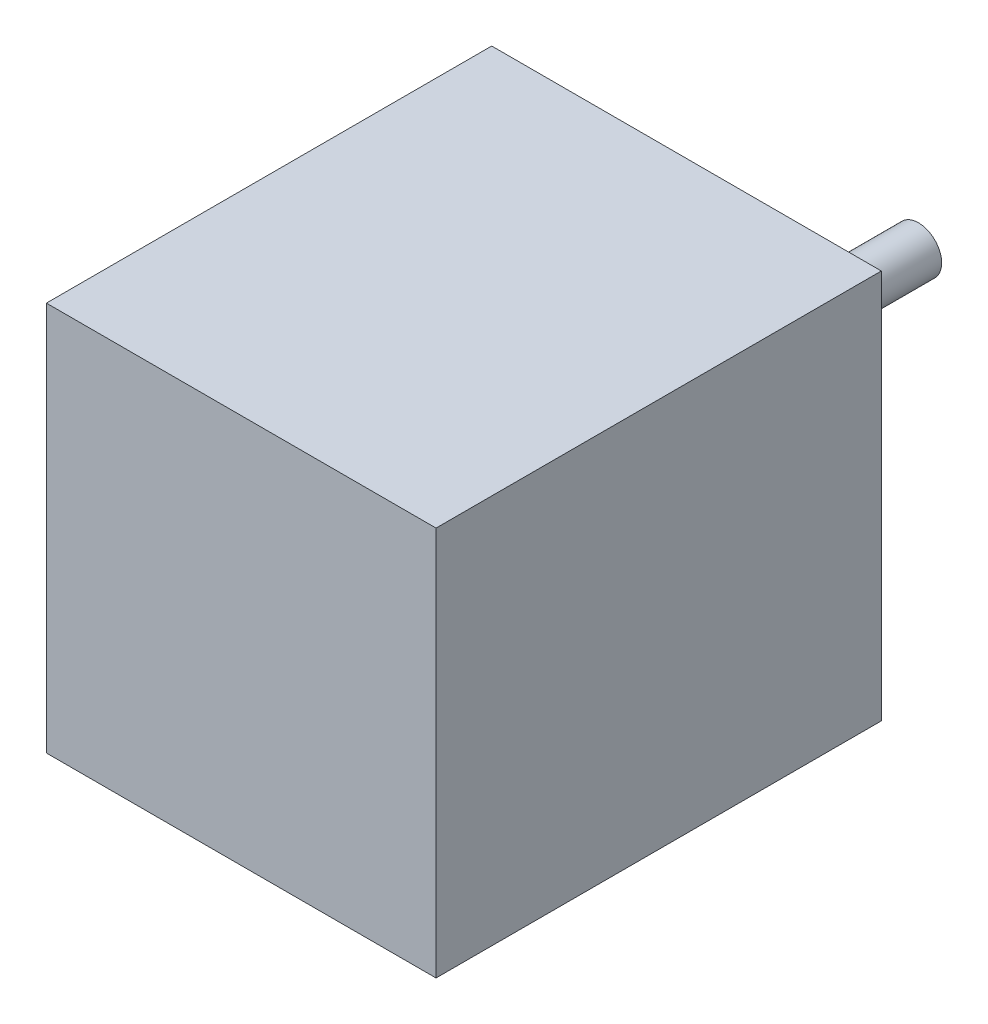
from build123d import *

# Parameters (mm, degrees)
SKETCH_1_W          = 42
SKETCH_1_H          = 42
EXTRUDE_1_DEPTH     = 48
SKETCH_3_R          = 11
EXTRUDE_2_DEPTH     = 2
SKETCH_4_R          = 2.5
EXTRUDE_3_DEPTH     = 23
SKETCH_5_R          = 1.5
CUT_EXTRUDE_1_DEPTH = 8


with BuildPart() as part:
    # 草图1 → 凸台-拉伸1 (new body)
    with BuildSketch(Plane.XY):
        with Locations((-21, 21)):
            Rectangle(SKETCH_1_W, SKETCH_1_H)
    extrude(amount=EXTRUDE_1_DEPTH)

    # 草图3 → 凸台-拉伸2 (add)
    with BuildSketch(Plane(origin=(0, 0, 0), x_dir=(-1, 0, 0), z_dir=(0, 0, -1))):
        with Locations((21, 21)):
            Circle(SKETCH_3_R)
    extrude(amount=EXTRUDE_2_DEPTH)

    # 草图4 → 凸台-拉伸3 (add)
    with BuildSketch(Plane(origin=(0, 0, -2), x_dir=(-1, 0, 0), z_dir=(0, 0, -1))):
        with Locations((21, 21)):
            Circle(SKETCH_4_R)
    extrude(amount=EXTRUDE_3_DEPTH)

    # 草图5 → 切除-拉伸1 (cut)
    with BuildSketch(Plane(origin=(0, 0, 0), x_dir=(-1, 0, 0), z_dir=(0, 0, -1))):
        with Locations((5.5, 5.5)):
            Circle(SKETCH_5_R)
        with Locations((36.5, 5.5)):
            Circle(SKETCH_5_R)
        with Locations((36.5, 36.5)):
            Circle(SKETCH_5_R)
        with Locations((5.5, 36.5)):
            Circle(SKETCH_5_R)
    extrude(amount=-CUT_EXTRUDE_1_DEPTH, mode=Mode.SUBTRACT)


solid = part.part
